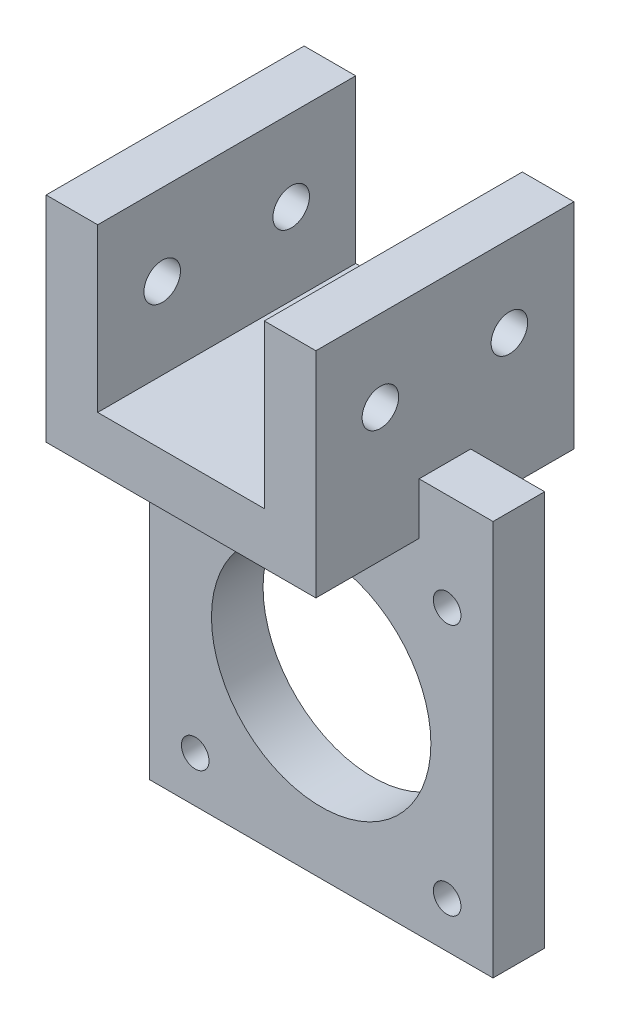
from build123d import *

# Parameters (mm, degrees)
SKETCH6_W                = 42.3
SKETCH6_H                = 42.3
SKETCH6_R                = 1.7
SKETCH6_R_2              = 13.5
BOSS_EXTRUDE4_DEPTH      = 6.35
SKETCH7_W                = 42.3
SKETCH7_H                = 6.35
BOSS_EXTRUDE5_DEPTH      = 6.35
SKETCH9_W                = 6.35
SKETCH9_H                = 6.35
BOSS_EXTRUDE7_DEPTH      = 20
BOSS_EXTRUDE9_DEPTH      = 12.7
BOSS_EXTRUDE9_DEPTH_BACK = 19.05
CUT_EXTRUDE3_DEPTH       = 62.003217128


with BuildPart() as part:
    # Sketch6 → Boss-Extrude4 (new body)
    with BuildSketch(Plane.XY):
        Rectangle(SKETCH6_W, SKETCH6_H)
        with Locations((-15.5, 15.5)):
            Circle(SKETCH6_R, mode=Mode.SUBTRACT)
        with Locations((15.5, 15.5)):
            Circle(SKETCH6_R, mode=Mode.SUBTRACT)
        with Locations((15.5, -15.5)):
            Circle(SKETCH6_R, mode=Mode.SUBTRACT)
        with Locations((-15.5, -15.5)):
            Circle(SKETCH6_R, mode=Mode.SUBTRACT)
        Circle(SKETCH6_R_2, mode=Mode.SUBTRACT)
    extrude(amount=BOSS_EXTRUDE4_DEPTH)

    # Sketch7 → Boss-Extrude5 (add)
    with BuildSketch(Plane(origin=(0, 21.15, 0), x_dir=(1, 0, 0), z_dir=(0, 1, 0))):
        with Locations((0, -3.175)):
            Rectangle(SKETCH7_W, SKETCH7_H)
    extrude(amount=BOSS_EXTRUDE5_DEPTH)

    # Sketch9 → Boss-Extrude7 (add)
    with BuildSketch(Plane(origin=(0, 27.5, 0), x_dir=(1, 0, 0), z_dir=(0, 1, 0))):
        with Locations((-17.975, -3.175)):
            Rectangle(SKETCH9_W, SKETCH9_H)
        with Locations((8.875, -3.175)):
            Rectangle(SKETCH9_W, SKETCH9_H)
    extrude(amount=BOSS_EXTRUDE7_DEPTH)

    # Sketch11 → Boss-Extrude9 (add, two sides: drawn at the far end of the back side and taken through both)
    with BuildSketch(Plane(origin=(0, 0, 0), x_dir=(-1, 0, 0), z_dir=(0, 0, -1)).offset(-BOSS_EXTRUDE9_DEPTH_BACK)):
        Polygon((-12.05, 47.5), (-12.05, 27.5), (-12.05, 21.15), (21.15, 21.15), (21.15, 47.5), (14.8, 47.5), (14.8, 27.5), (-5.7, 27.5), (-5.7, 47.5), align=None)
    extrude(amount=BOSS_EXTRUDE9_DEPTH + BOSS_EXTRUDE9_DEPTH_BACK)

    # Sketch12 → Cut-Extrude3 (cut, through all)
    with BuildSketch(Plane(origin=(12.05, 0, 0), x_dir=(0, 0, -1), z_dir=(1, 0, 0))):
        with BuildLine():
            ThreePointArc((2.5125, 37.5), (4.7625, 35.25), (7.0125, 37.5))
            Line((7.0125, 37.5), (2.5125, 37.5))
        make_face()
        with BuildLine():
            Line((2.5125, 37.5), (7.0125, 37.5))
            ThreePointArc((7.0125, 37.5), (4.7625, 39.75), (2.5125, 37.5))
        make_face()
        with BuildLine():
            ThreePointArc((-13.3625, 37.5), (-11.1125, 35.25), (-8.8625, 37.5))
            Line((-8.8625, 37.5), (-13.3625, 37.5))
        make_face()
        with BuildLine():
            Line((-13.3625, 37.5), (-8.8625, 37.5))
            ThreePointArc((-8.8625, 37.5), (-11.1125, 39.75), (-13.3625, 37.5))
        make_face()
    extrude(amount=-CUT_EXTRUDE3_DEPTH, mode=Mode.SUBTRACT)


solid = part.part
